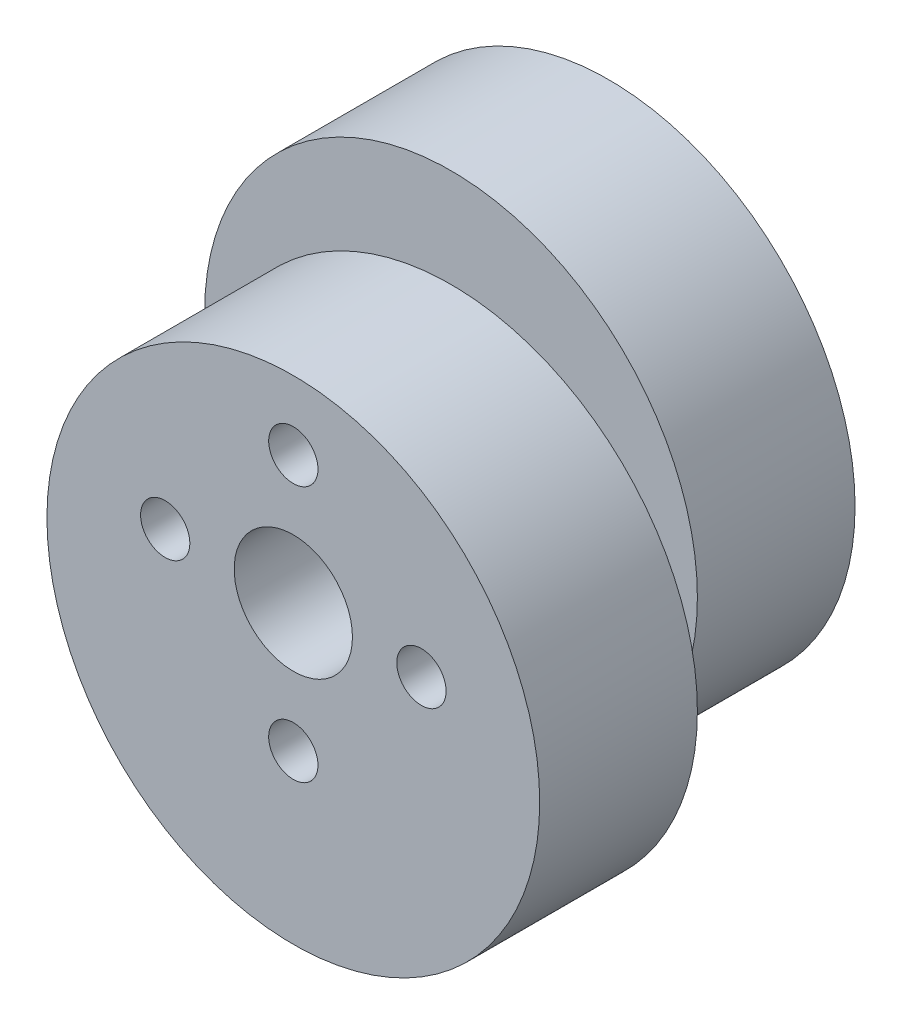
from build123d import *

# Parameters (mm, degrees)
SKETCH_1_R      = 12.5
SKETCH_1_R_2    = 1.25
SKETCH_1_R_3    = 3
EXTRUDE_3_DEPTH = 8
SKETCH_4_R      = 12.5
SKETCH_4_R_2    = 1.25
SKETCH_4_R_3    = 3
EXTRUDE_4_DEPTH = 8


with BuildPart() as part:
    # ｽｹｯﾁ1 → ﾎﾞｽ - 押し出し3 (new body)
    with BuildSketch(Plane.XY):
        Circle(SKETCH_1_R)
        with Locations((0, -4)):
            Circle(SKETCH_1_R_2, mode=Mode.SUBTRACT)
        with Locations((-6.5, 2.5)):
            Circle(SKETCH_1_R_2, mode=Mode.SUBTRACT)
        with Locations((0, 9)):
            Circle(SKETCH_1_R_2, mode=Mode.SUBTRACT)
        with Locations((6.5, 2.5)):
            Circle(SKETCH_1_R_2, mode=Mode.SUBTRACT)
        with Locations((0, 2.5)):
            Circle(SKETCH_1_R_3, mode=Mode.SUBTRACT)
    extrude(amount=EXTRUDE_3_DEPTH)


with BuildPart() as body_2:
    # ｽｹｯﾁ4 → ﾎﾞｽ - 押し出し4 (new body)
    with BuildSketch(Plane(origin=(0, 0, 0), x_dir=(-1, 0, 0), z_dir=(0, 0, -1))):
        with Locations((0, 5)):
            Circle(SKETCH_4_R)
        with Locations((0, 9)):
            Circle(SKETCH_4_R_2, mode=Mode.SUBTRACT)
        with Locations((6.5, 2.5)):
            Circle(SKETCH_4_R_2, mode=Mode.SUBTRACT)
        with Locations((0, -4)):
            Circle(SKETCH_4_R_2, mode=Mode.SUBTRACT)
        with Locations((-6.5, 2.5)):
            Circle(SKETCH_4_R_2, mode=Mode.SUBTRACT)
        with Locations((0, 2.5)):
            Circle(SKETCH_4_R_3, mode=Mode.SUBTRACT)
    extrude(amount=EXTRUDE_4_DEPTH)


solid = Compound([part.part, body_2.part])
